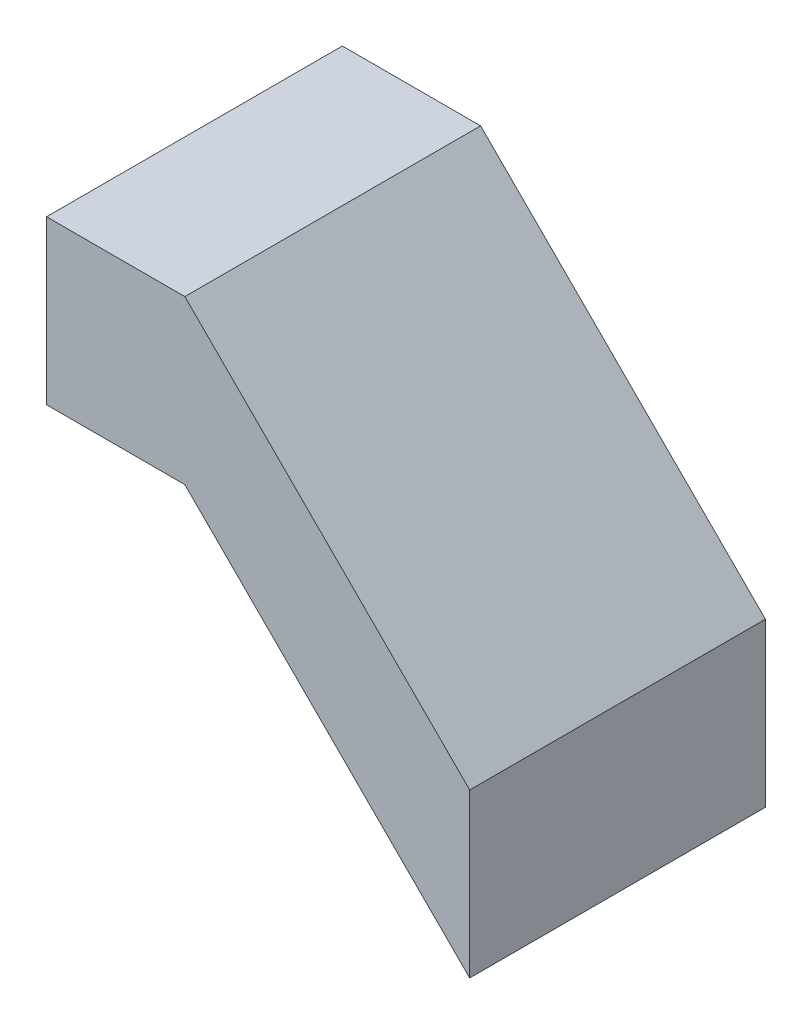
from build123d import *

# Parameters (mm, degrees)
SALIENTE_EXTRUIR1_DEPTH = 9.08
SALIENTE_EXTRUIR2_DEPTH = 1.5
SALIENTE_EXTRUIR3_DEPTH = 4.08


with BuildPart() as part:
    # Croquis1 → Saliente-Extruir1 (new body)
    with BuildSketch(Plane.XY):
        Polygon((193.75453947, -55.999935), (193.75453947, -50.999935), (197.99984, -50.999935), (206.74514053, -59.74523553), (206.74514053, -64.74523553), (204.74514053, -62.74523553), (204.74514053, -60.24523553), (200.74514053, -56.24523553), (200.74514053, -58.74523553), (197.99984, -55.999935), align=None)
    extrude(amount=-SALIENTE_EXTRUIR1_DEPTH)

    # Croquis2 → Saliente-Extruir2 (add)
    with BuildSketch(Plane.XY):
        Polygon((200.74514053, -58.74523553), (200.74514053, -56.24523553), (204.74514053, -60.24523553), (204.74514053, -62.74523553), align=None)
    extrude(amount=-SALIENTE_EXTRUIR2_DEPTH)

    # Croquis3 → Saliente-Extruir3 (add)
    with BuildSketch(Plane(origin=(0, 0, -9.08), x_dir=(-1, 0, 0), z_dir=(0, 0, -1))):
        Polygon((-204.74514053, -62.74523553), (-204.74514053, -60.24523553), (-200.74514053, -56.24523553), (-200.74514053, -58.74523553), align=None)
    extrude(amount=-SALIENTE_EXTRUIR3_DEPTH)


solid = part.part
